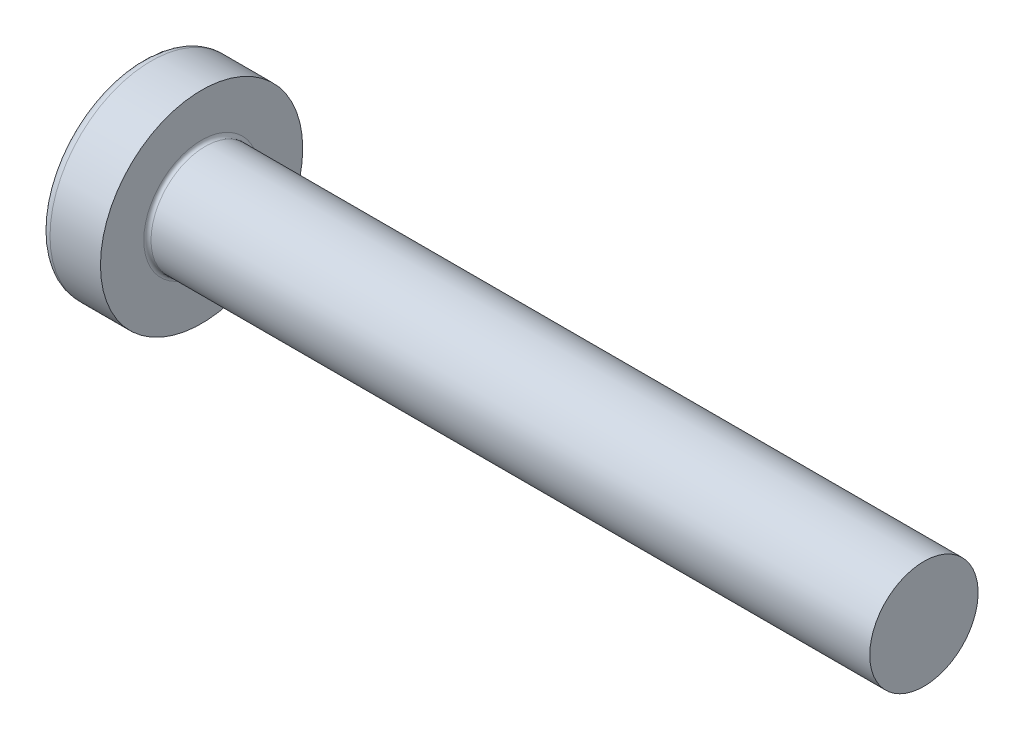
from build123d import *

# Parameters (mm, degrees)
FILLET1_R    = 0.1
RECPAT_COUNT = 2
RECPAT_ANGLE = 90


with BuildPart() as part:
    # BodySke → Base-Revolve (revolve)
    with BuildSketch(Plane.XY, mode=Mode.PRIVATE) as base_revolve_sk:
        with BuildLine():
            Line((2.4, 1.5), (2.4, 2.8))
            Line((2.4, 2.8), (1.003501533, 2.8))
            ThreePointArc((1.003501533, 2.8), (0.873295971, 2.76653015), (0.775371599, 2.674418605))
            ThreePointArc((0.775371599, 2.674418605), (0.197753546, 1.392274756), (0, 0))
            Line((0, 0), (22.4, 0))
            Line((22.4, 0), (22.4, 1.5))
            Line((22.4, 1.5), (2.4, 1.5))
        make_face()
    revolve(base_revolve_sk.sketch.rotate(Axis((1.003501533, 0, 0), (1, 0, 0)), 90), axis=Axis((1.003501533, 0, 0), (1, 0, 0)))

    # Fillet1
    fillet1_edges = [part.edges().sort_by_distance(p)[0] for p in [
        (2.4, 0, -1.5),
    ]]
    fillet(fillet1_edges, radius=FILLET1_R)

    # Sketch3 → Recess section 0
    with BuildSketch(Plane(origin=(0, 0, 0), x_dir=(0, 0, -1), z_dir=(1, 0, 0))):
        with BuildLine():
            Line((0.37, -1.4), (-0.37, -1.4))
            Line((-0.37, -1.4), (-0.37, 1.4))
            Line((-0.37, 1.4), (0.37, 1.4))
            Line((0.37, 1.4), (0.37, -1.4))
        make_face()
    # Sketch4 → Recess section 1
    with BuildSketch(Plane(origin=(1.75, 0, 0), x_dir=(0, 0, -1), z_dir=(1, 0, 0))):
        with BuildLine():
            Line((0.37, -0.527482332), (-0.37, -0.527482332))
            Line((-0.37, -0.527482332), (-0.37, 0.527482332))
            Line((-0.37, 0.527482332), (0.37, 0.527482332))
            Line((0.37, 0.527482332), (0.37, -0.527482332))
        make_face()
    recess = loft(mode=Mode.SUBTRACT)

    # RecPat: Recess ×2 about axis
    recpat_axis = Axis((0, 0, 0), (1, 0, 0))
    for i in range(1, RECPAT_COUNT):
        add(recess.rotate(recpat_axis, i * RECPAT_ANGLE / (RECPAT_COUNT - 1)), mode=Mode.SUBTRACT)

    # RecCorSke → RecessCore (revolve, cut)
    with BuildSketch(Plane.XY, mode=Mode.PRIVATE) as recesscore_sk:
        Polygon((0, 0), (0, 0.678371921), (1.75, 0.556), (1.930655351, 0), align=None)
    revolve(recesscore_sk.sketch.rotate(Axis((-3.175, 0, 0), (1, 0, 0)), 15.814025638), axis=Axis((-3.175, 0, 0), (1, 0, 0)), mode=Mode.SUBTRACT)


solid = part.part
